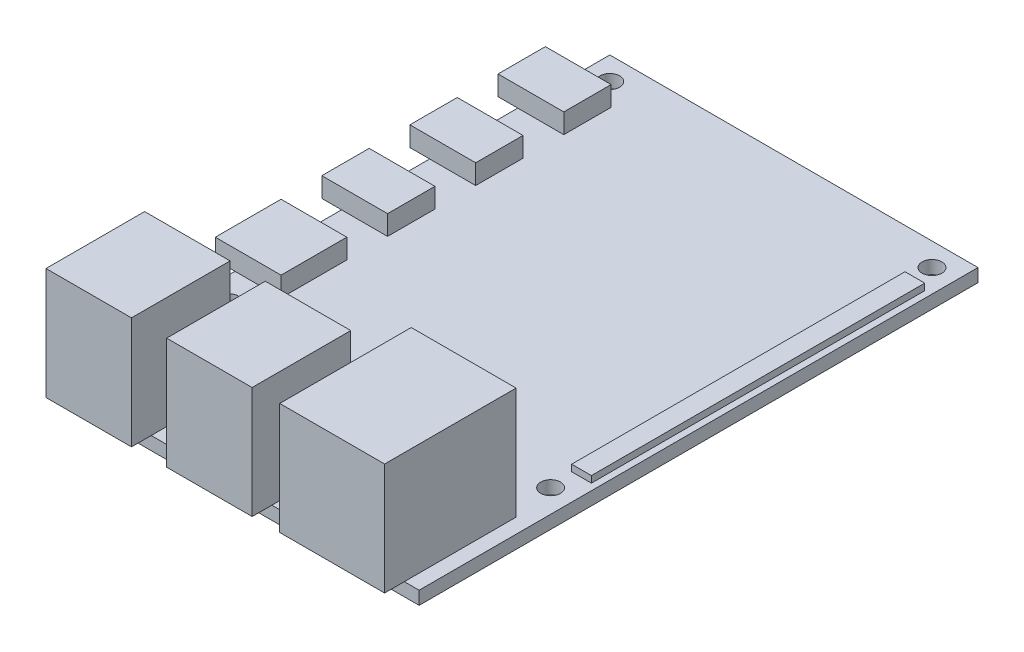
from build123d import *

# Parameters (mm, degrees)
SKETCH1_W           = 56
SKETCH1_H           = 85
SKETCH1_R           = 1.5
BOSS_EXTRUDE1_DEPTH = 2
SKETCH2_W           = 3
SKETCH2_H           = 50.7
BOSS_EXTRUDE2_DEPTH = 1
SKETCH3_W           = 13
SKETCH3_H           = 15
SKETCH3_W_2         = 15.95
SKETCH3_H_2         = 20
BOSS_EXTRUDE3_DEPTH = 17
SKETCH4_W           = 10
SKETCH4_H           = 7.2
SKETCH4_H_2         = 10
BOSS_EXTRUDE4_DEPTH = 3


with BuildPart() as part:
    # Sketch1 → Boss-Extrude1 (new body)
    with BuildSketch(Plane(origin=(0, 0, 0), x_dir=(1, 0, 0), z_dir=(0, 1, 0))):
        Rectangle(SKETCH1_W, SKETCH1_H)
        with Locations(Location((-24.5, 39, 0), (0, 0, 270))):
            Circle(SKETCH1_R, mode=Mode.SUBTRACT)
        with Locations(Location((24.5, 39, 0), (0, 0, 270))):
            Circle(SKETCH1_R, mode=Mode.SUBTRACT)
        with Locations(Location((-24.5, -19, 0), (0, 0, 270))):
            Circle(SKETCH1_R, mode=Mode.SUBTRACT)
        with Locations(Location((24.5, -19, 0), (0, 0, 270))):
            Circle(SKETCH1_R, mode=Mode.SUBTRACT)
    extrude(amount=BOSS_EXTRUDE1_DEPTH)

    # Sketch2 → Boss-Extrude2 (add)
    with BuildSketch(Plane(origin=(0, 2, 0), x_dir=(1, 0, 0), z_dir=(0, 1, 0))):
        with Locations((25.5, 10.05)):
            Rectangle(SKETCH2_W, SKETCH2_H)
    extrude(amount=BOSS_EXTRUDE2_DEPTH)

    # Sketch3 → Boss-Extrude3 (add)
    with BuildSketch(Plane(origin=(0, 2, 0), x_dir=(1, 0, 0), z_dir=(0, 1, 0))):
        with Locations((-19.25, -38)):
            Rectangle(SKETCH3_W, SKETCH3_H)
        with Locations((-0.9, -38)):
            Rectangle(SKETCH3_W, SKETCH3_H)
        with Locations((17.775, -35.5)):
            Rectangle(SKETCH3_W_2, SKETCH3_H_2)
    extrude(amount=BOSS_EXTRUDE3_DEPTH)

    # Sketch4 → Boss-Extrude4 (add)
    with BuildSketch(Plane(origin=(0, 2, 0), x_dir=(1, 0, 0), z_dir=(0, 1, 0))):
        with Locations((-26, 32.1)):
            Rectangle(SKETCH4_W, SKETCH4_H)
        with Locations((-26, 5.3)):
            Rectangle(SKETCH4_W, SKETCH4_H)
        with Locations((-26, -9.5)):
            Rectangle(SKETCH4_W, SKETCH4_H_2)
        with Locations((-26, 18.7)):
            Rectangle(SKETCH4_W, SKETCH4_H)
    extrude(amount=BOSS_EXTRUDE4_DEPTH)


solid = part.part
